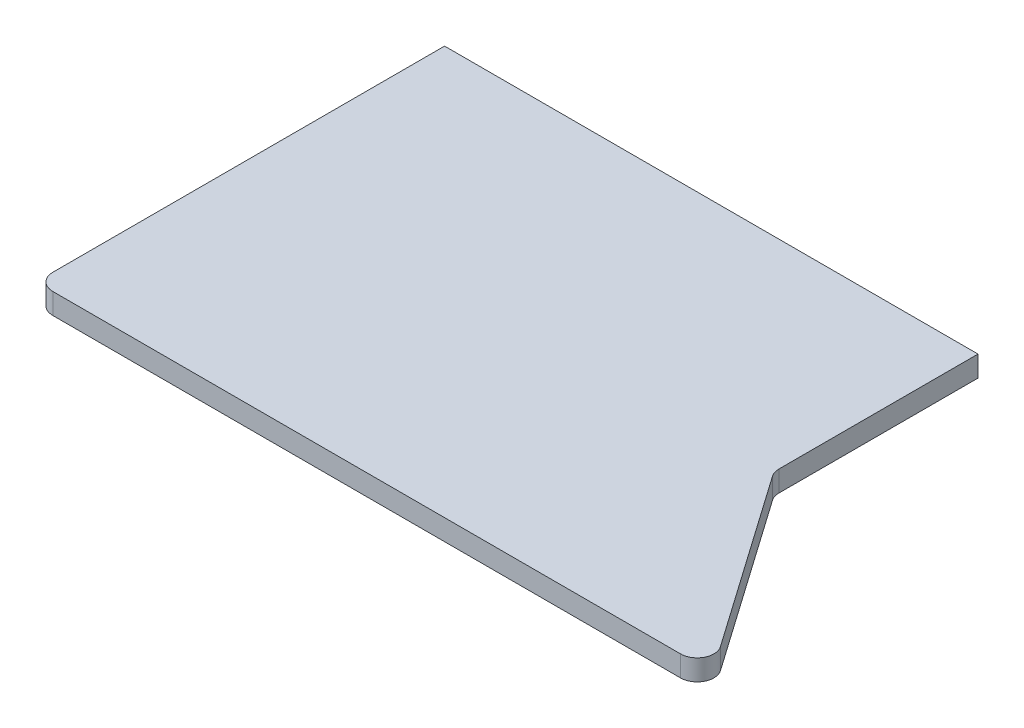
from build123d import *

# Parameters (mm, degrees)
SKETCH1_W           = 81.28
SKETCH1_H           = 62.23
BOSS_EXTRUDE1_DEPTH = 3.175
FILLET1_R           = 2.54


with BuildPart() as part:
    # Sketch1 → Boss-Extrude1 (new body)
    with BuildSketch(Plane(origin=(0, 0, 0), x_dir=(1, 0, 0), z_dir=(0, 1, 0))):
        Polygon((103.066957551, 0), (81.28, 31.115), (81.28, 0), align=None)
        with Locations((40.64, 31.115)):
            Rectangle(SKETCH1_W, SKETCH1_H)
    extrude(amount=BOSS_EXTRUDE1_DEPTH)

    # Fillet1
    fillet1_edges = [part.edges().sort_by_distance(p)[0] for p in [
        (0, 1.5875, 0),
        (81.28, 1.5875, -31.115),
        (103.066957551, 1.5875, 0),
    ]]
    fillet(fillet1_edges, radius=FILLET1_R)


solid = part.part
